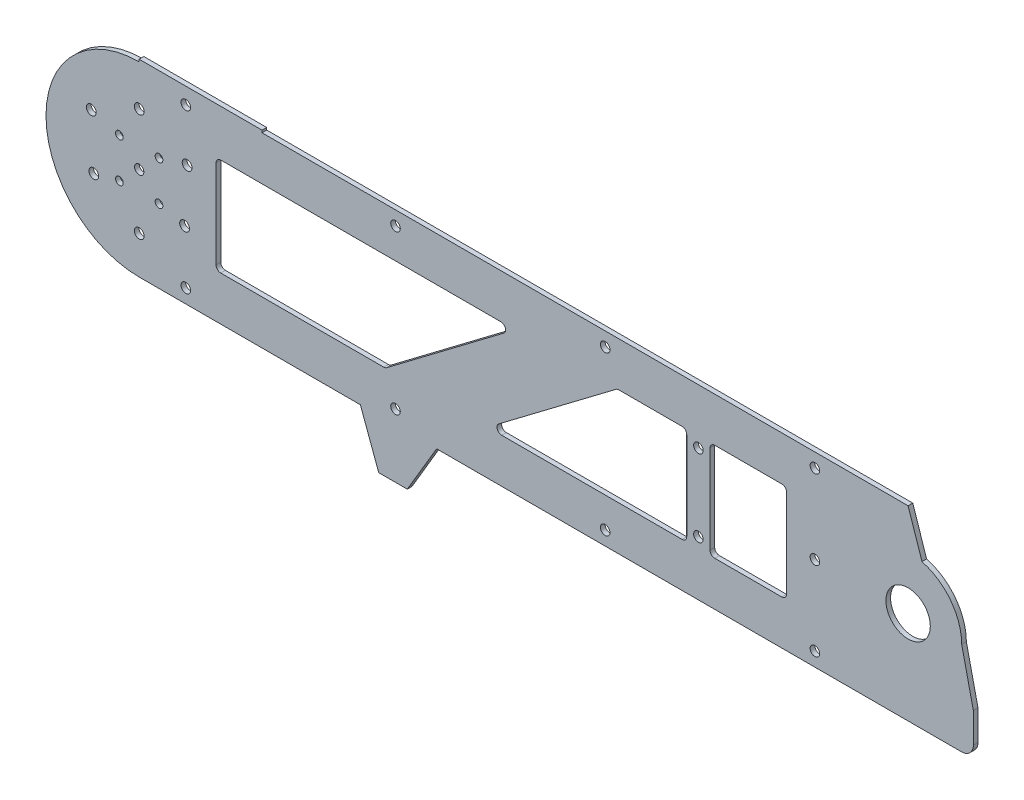
from build123d import *

# Parameters (mm, degrees)
SKETCH_1_R          = 2.1
SKETCH_1_R_2        = 2
SKETCH_1_R_3        = 9.52
SKETCH_1_R_4        = 2.05
SKETCH_1_R_5        = 1.65
EXTRUDE_1_DEPTH     = 2
SKETCH_3_W          = 52.726125437
SKETCH_3_H          = 0.98
EXTRUDE_2_DEPTH     = 2
SKETCH_2_R          = 2.05
SKETCH_2_W          = 32.809844138
SKETCH_2_H          = 42
CUT_EXTRUDE_1_DEPTH = 4
FILLET_1_R          = 2
FILLET_2_R          = 5


with BuildPart() as part:
    # 草图1 → 凸台-拉伸1 (new body)
    with BuildSketch(Plane.XY):
        with BuildLine():
            Line((-1.457142857, 39.854285714), (328.542857143, 39.854285714))
            Line((328.542857143, 39.854285714), (334.49569518, 22.070579719))
            ThreePointArc((334.49569518, 22.070579719), (346.78998397, 13.855798581), (351.542857143, -0.145714286))
            Line((351.542857143, -0.145714286), (356.542857143, -22.235997541))
            Line((356.542857143, -22.235997541), (356.542857143, -40.145714286))
            Line((356.542857143, -40.145714286), (328.542857143, -40.145714286))
            Line((328.542857143, -40.145714286), (126.194823947, -40.145714286))
            Line((126.194823947, -40.145714286), (113.608549915, -61.445714286))
            Line((113.608549915, -61.445714286), (101.341389716, -61.445714286))
            Line((101.341389716, -61.445714286), (93.462833584, -40.145714286))
            Line((93.462833584, -40.145714286), (-1.457142857, -40.145714286))
            ThreePointArc((-1.457142857, -40.145714286), (-41.457142857, -0.145714286), (-1.457142857, 39.854285714))
        make_face()
        with Locations((-1.457142857, -23.895714286)):
            Circle(SKETCH_1_R, mode=Mode.SUBTRACT)
        with Locations((18.028428728, -11.395714286)):
            Circle(SKETCH_1_R, mode=Mode.SUBTRACT)
        with Locations((-1.457142857, -0.145714286)):
            Circle(SKETCH_1_R_2, mode=Mode.SUBTRACT)
        with Locations((328.542857143, -0.145714286)):
            Circle(SKETCH_1_R_3, mode=Mode.SUBTRACT)
        with Locations((288.542857143, -0.145714286)):
            Circle(SKETCH_1_R_4, mode=Mode.SUBTRACT)
        with Locations((238.542857143, 16.354285714)):
            Circle(SKETCH_1_R_4, mode=Mode.SUBTRACT)
        with Locations(Location((238.542857143, -16.645714286, 0), (0, 0, 180))):
            Circle(SKETCH_1_R_4, mode=Mode.SUBTRACT)
        with Locations((-20.942714442, -11.395714286)):
            Circle(SKETCH_1_R, mode=Mode.SUBTRACT)
        with Locations((-22.025246197, 11.729285714)):
            Circle(SKETCH_1_R, mode=Mode.SUBTRACT)
        with Locations((-1.457142857, 22.354285714)):
            Circle(SKETCH_1_R, mode=Mode.SUBTRACT)
        with Locations((19.110960483, 11.729285714)):
            Circle(SKETCH_1_R, mode=Mode.SUBTRACT)
        with Locations((7.042857143, -8.645714286)):
            Circle(SKETCH_1_R_5, mode=Mode.SUBTRACT)
        with Locations((-9.957142857, -8.645714286)):
            Circle(SKETCH_1_R_5, mode=Mode.SUBTRACT)
        with Locations((-9.957142857, 8.354285714)):
            Circle(SKETCH_1_R_5, mode=Mode.SUBTRACT)
        with Locations((7.042857143, 8.354285714)):
            Circle(SKETCH_1_R_5, mode=Mode.SUBTRACT)
    extrude(amount=EXTRUDE_1_DEPTH)

    # 草图3 → 凸台-拉伸2 (add)
    with BuildSketch(Plane.XY.offset(2)):
        with Locations((24.905919862, 40.344285714)):
            Rectangle(SKETCH_3_W, SKETCH_3_H)
    extrude(amount=-EXTRUDE_2_DEPTH)

    # 草图2 → 切除-拉伸1 (cut)
    with BuildSketch(Plane.XY.offset(2)):
        with Locations((18.542857143, 33.854285714)):
            Circle(SKETCH_2_R)
        with Locations((108.542857143, 33.854285714)):
            Circle(SKETCH_2_R)
        with Locations((198.542857143, 33.854285714)):
            Circle(SKETCH_2_R)
        with Locations((288.542857143, 33.854285714)):
            Circle(SKETCH_2_R)
        with Locations((108.542857143, -34.145714286)):
            Circle(SKETCH_2_R)
        with Locations((198.542857143, -34.145714286)):
            Circle(SKETCH_2_R)
        with Locations((288.542857143, -34.145714286)):
            Circle(SKETCH_2_R)
        with Locations((18.542857143, -34.145714286)):
            Circle(SKETCH_2_R)
        Polygon((31.542857143, -21.145714286), (104.183898028, -21.145714286), (159.772133322, 20.854285714), (31.542857143, 20.854285714), align=None)
        Polygon((148.123425102, -21.145714286), (203.711660396, 20.854285714), (233.542857143, 20.854285714), (233.542857143, -21.145714286), align=None)
        with Locations((259.947779212, -0.145714286)):
            Rectangle(SKETCH_2_W, SKETCH_2_H)
    extrude(amount=-CUT_EXTRUDE_1_DEPTH, mode=Mode.SUBTRACT)

    # 圆角1
    fillet_1_edges = [part.edges().sort_by_distance(p)[0] for p in [
        (31.542857143, -21.145714286, 1),
        (31.542857143, 20.854285714, 1),
        (159.772133322, 20.854285714, 1),
        (104.183898028, -21.145714286, 1),
        (243.542857143, 20.854285714, 1),
        (276.352701281, 20.854285714, 1),
        (276.352701281, -21.145714286, 1),
        (243.542857143, -21.145714286, 1),
        (203.711660396, 20.854285714, 1),
        (233.542857143, 20.854285714, 1),
        (233.542857143, -21.145714286, 1),
        (148.123425102, -21.145714286, 1),
    ]]
    fillet(fillet_1_edges, radius=FILLET_1_R)

    # 圆角2
    fillet_2_edges = [part.edges().sort_by_distance(p)[0] for p in [
        (356.542857143, -40.145714286, 1),
    ]]
    fillet(fillet_2_edges, radius=FILLET_2_R)


solid = part.part
